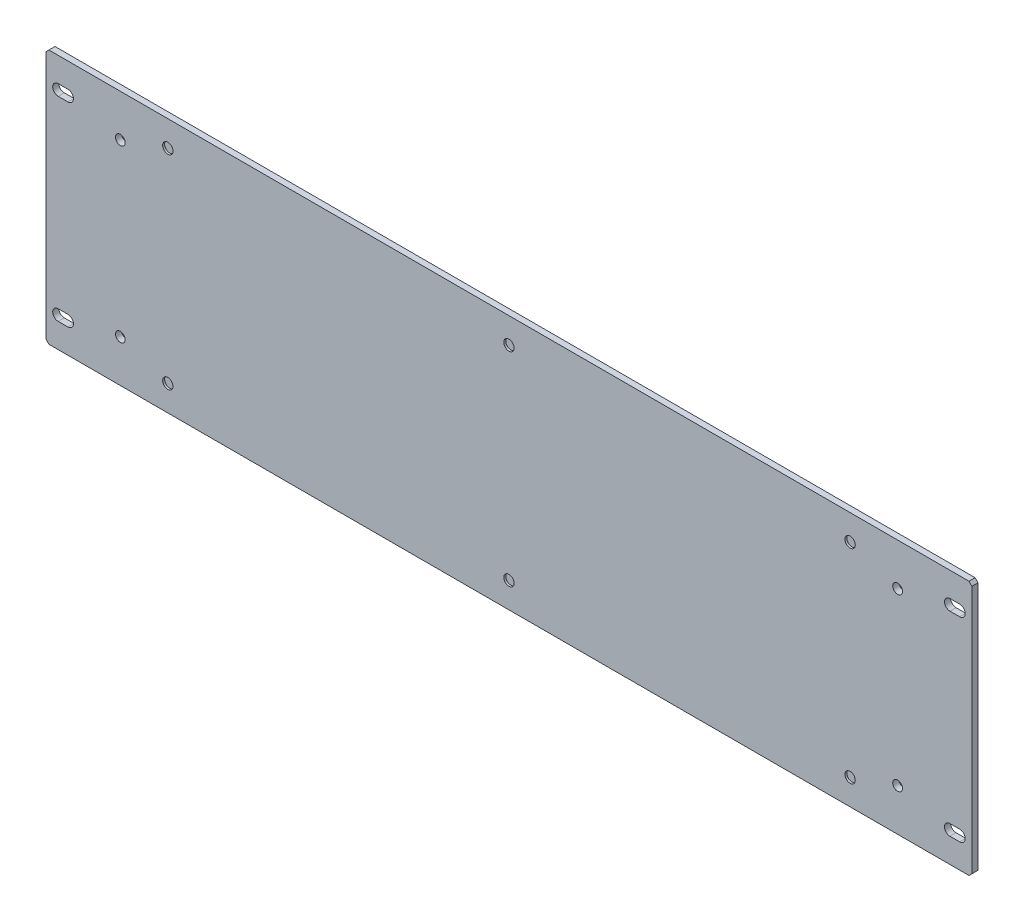
from build123d import *

# Parameters (mm, degrees)
SKETCH1_W           = 482.6
SKETCH1_H           = 132.842
SKETCH1_R           = 2.54
BOSS_EXTRUDE1_DEPTH = 3.175
SKETCH5_R           = 2.7051
CUT_EXTRUDE2_DEPTH  = 1.0414
CHAMFER1_SIZE       = 1.524


with BuildPart() as part:
    # Sketch1 → Boss-Extrude1 (new body)
    with BuildSketch(Plane.XY):
        with Locations((177.679566293, -52.618193378)):
            Rectangle(SKETCH1_W, SKETCH1_H)
        with Locations((-24.885433707, -8.168193378)):
            Circle(SKETCH1_R, mode=Mode.SUBTRACT)
        with Locations((-24.885433707, -97.068193378)):
            Circle(SKETCH1_R, mode=Mode.SUBTRACT)
        with Locations((380.244566293, -97.068193378)):
            Circle(SKETCH1_R, mode=Mode.SUBTRACT)
        with Locations((380.244566293, -8.168193378)):
            Circle(SKETCH1_R, mode=Mode.SUBTRACT)
        with BuildLine():
            Line((-57.270433707, 1.039306622), (-52.190433707, 1.039306622))
            ThreePointArc((-52.190433707, 1.039306622), (-49.332933707, -1.818193378), (-52.190433707, -4.675693378))
            Line((-52.190433707, -4.675693378), (-57.270433707, -4.675693378))
            ThreePointArc((-57.270433707, -4.675693378), (-60.127933707, -1.818193378), (-57.270433707, 1.039306622))
        make_face(mode=Mode.SUBTRACT)
        with BuildLine():
            Line((407.549566293, 1.039306622), (412.629566293, 1.039306622))
            ThreePointArc((412.629566293, 1.039306622), (415.487066293, -1.818193378), (412.629566293, -4.675693378))
            Line((412.629566293, -4.675693378), (407.549566293, -4.675693378))
            ThreePointArc((407.549566293, -4.675693378), (404.692066293, -1.818193378), (407.549566293, 1.039306622))
        make_face(mode=Mode.SUBTRACT)
        with BuildLine():
            Line((-57.270433707, -100.560693378), (-52.190433707, -100.560693378))
            ThreePointArc((-52.190433707, -100.560693378), (-49.332933707, -103.418193378), (-52.190433707, -106.275693378))
            Line((-52.190433707, -106.275693378), (-57.270433707, -106.275693378))
            ThreePointArc((-57.270433707, -106.275693378), (-60.127933707, -103.418193378), (-57.270433707, -100.560693378))
        make_face(mode=Mode.SUBTRACT)
        with BuildLine():
            Line((407.549566293, -100.560693378), (412.629566293, -100.560693378))
            ThreePointArc((412.629566293, -100.560693378), (415.487066293, -103.418193378), (412.629566293, -106.275693378))
            Line((412.629566293, -106.275693378), (407.549566293, -106.275693378))
            ThreePointArc((407.549566293, -106.275693378), (404.692066293, -103.418193378), (407.549566293, -100.560693378))
        make_face(mode=Mode.SUBTRACT)
    extrude(amount=BOSS_EXTRUDE1_DEPTH)

    # Sketch5 → Cut-Extrude2 (cut)
    with BuildSketch(Plane.XY.offset(3.175)):
        with Locations((-0.120433707, 0.467806622)):
            Circle(SKETCH5_R)
        with Locations((177.679566293, 0.467806622)):
            Circle(SKETCH5_R)
        with Locations((355.479566293, 0.467806622)):
            Circle(SKETCH5_R)
        with Locations((177.679566293, -105.704193378)):
            Circle(SKETCH5_R)
        with Locations((355.479566293, -105.704193378)):
            Circle(SKETCH5_R)
        with Locations((-0.120433707, -105.704193378)):
            Circle(SKETCH5_R)
    extrude(amount=-CUT_EXTRUDE2_DEPTH, mode=Mode.SUBTRACT)

    # Chamfer1
    chamfer1_edges = [part.edges().sort_by_distance(p)[0] for p in [
        (-63.620433707, 13.802806622, 1.5875),
        (418.979566293, 13.802806622, 1.5875),
        (418.979566293, -119.039193378, 1.5875),
        (-63.620433707, -119.039193378, 1.5875),
    ]]
    chamfer(chamfer1_edges, length=CHAMFER1_SIZE)


solid = part.part
